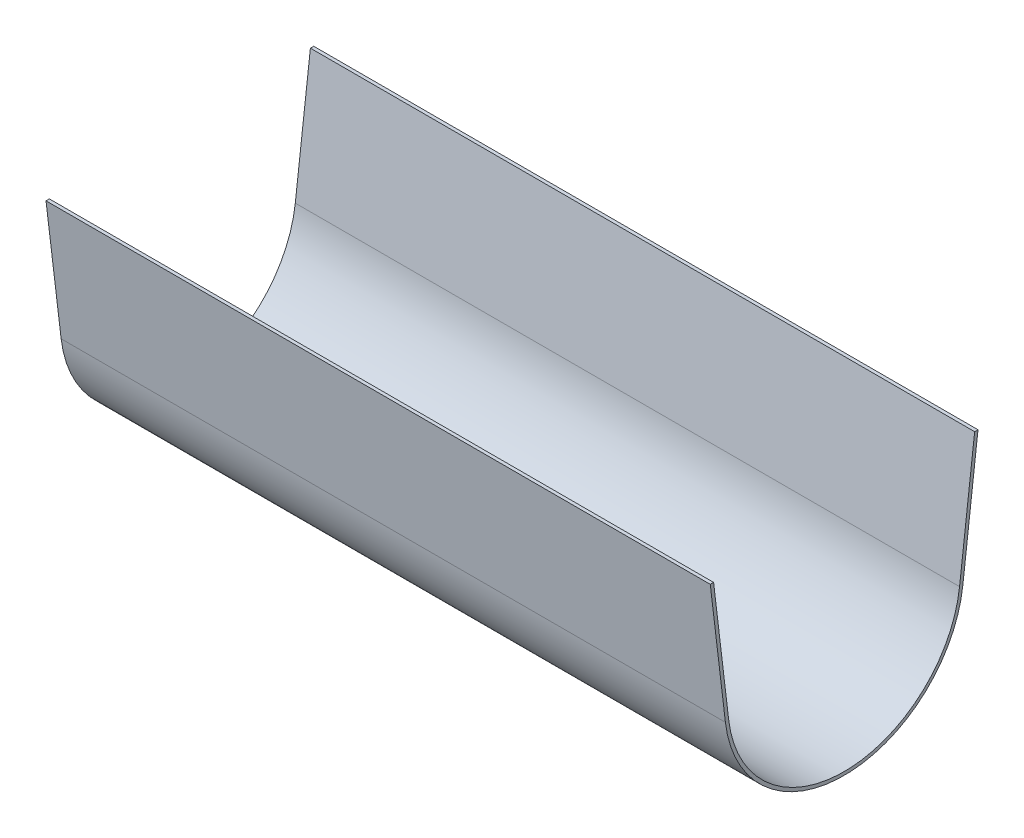
from build123d import *

# Parameters (mm, degrees)
BOSS_EXTRUDE1_DEPTH = 100


with BuildPart() as part:
    # Sketch1 → Boss-Extrude1 (new, symmetric)
    with BuildSketch(Plane(origin=(0, 0, 0), x_dir=(0, 0, -1), z_dir=(1, 0, 0))):
        with BuildLine():
            Line((-40.305, 0), (-35.747229353, -38.258590561))
            ThreePointArc((-35.747229353, -38.258590561), (0, -70), (35.747229353, -38.258590561))
            Line((35.747229353, -38.258590561), (40.305, 0))
            Line((40.305, 0), (39.297928944, 0))
            Line((39.297928944, 0), (34.75425076, -38.140296379))
            ThreePointArc((34.75425076, -38.140296379), (0, -69), (-34.75425076, -38.140296379))
            Line((-34.75425076, -38.140296379), (-39.297928944, 0))
            Line((-39.297928944, 0), (-40.305, 0))
        make_face()
    extrude(amount=BOSS_EXTRUDE1_DEPTH, both=True)


solid = part.part
